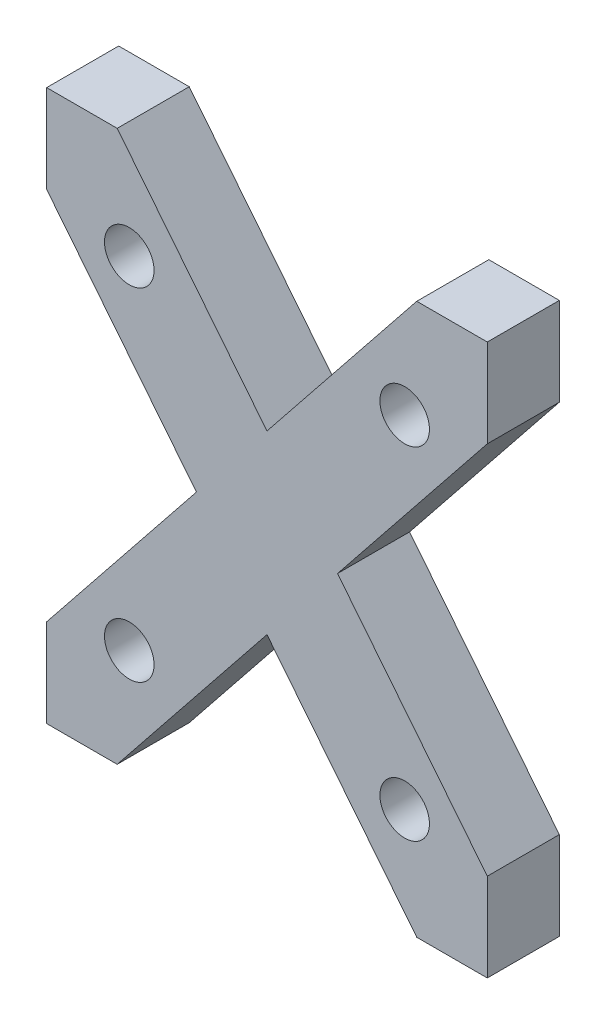
from build123d import *

# Parameters (mm, degrees)
SKETCH1_W            = 40
SKETCH1_H            = 50
BOSS_EXTRUDE1_DEPTH  = 6.54
M4_CLEARANCE_HOLE1_D = 4.5
CUT_EXTRUDE1_DEPTH   = 33.676774627


with BuildPart() as part:
    # Sketch1 → Boss-Extrude1 (new body)
    with BuildSketch(Plane.XY):
        Rectangle(SKETCH1_W, SKETCH1_H)
    extrude(amount=BOSS_EXTRUDE1_DEPTH)

    # M4 Clearance Hole1 (through all)
    with Locations(Plane(origin=(0, 0, 0), x_dir=(-1, 0, 0), z_dir=(0, 0, -1))):
        with Locations((-12.5, 15.5), (12.5, 15.5), (12.5, -15.5), (-12.5, -15.5)):
            Hole(M4_CLEARANCE_HOLE1_D / 2)

    # Sketch6 → Cut-Extrude1 (cut, through all)
    with BuildSketch(Plane(origin=(0, 0, 0), x_dir=(-1, 0, 0), z_dir=(0, 0, -1))):
        Polygon((20, 16.996094703), (20, -16.996094703), (6.403124237, 0), align=None)
        Polygon((13.596875763, -25), (-13.596875763, -25), (0, -8.003905297), align=None)
        Polygon((-20, 16.996094703), (-20, -16.996094703), (-6.403124237, 0), align=None)
        Polygon((-13.596875763, 25), (13.596875763, 25), (0, 8.003905297), align=None)
    extrude(amount=-CUT_EXTRUDE1_DEPTH, mode=Mode.SUBTRACT)


solid = part.part
